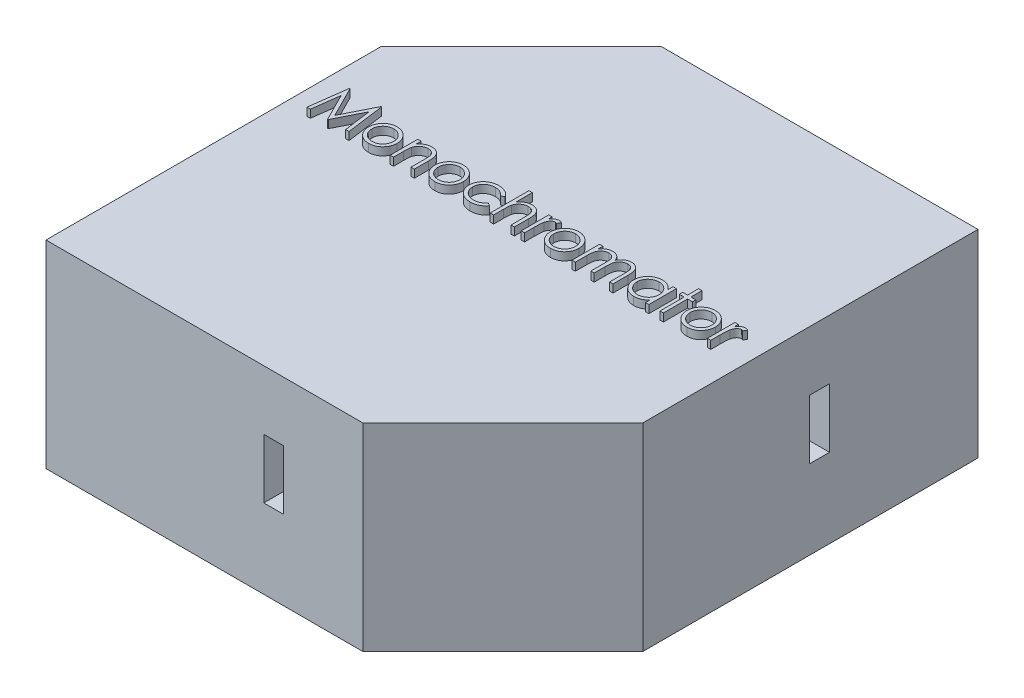
from build123d import *

# Parameters (mm, degrees)
BOSS_EXTRUDE1_DEPTH = 50
SKETCH3_W           = 5
SKETCH3_H           = 15
CUT_EXTRUDE1_DEPTH  = 50
SKETCH4_W           = 5
SKETCH4_H           = 15
CUT_EXTRUDE2_DEPTH  = 50
BOSS_EXTRUDE2_DEPTH = 3
BOSS_EXTRUDE3_DEPTH = 3
BOSS_EXTRUDE4_DEPTH = 2


with BuildPart() as part:
    # Sketch2 → Boss-Extrude1 (new body)
    with BuildSketch(Plane(origin=(0, 0, 0), x_dir=(1, 0, 0), z_dir=(0, 1, 0))):
        Polygon((0, 0), (80, 0), (115.355339059, 35.355339059), (115.355339059, 120), (35.355339059, 120), (0, 84.644660941), align=None)
        Polygon((5, 5), (77.928932188, 5), (110.355339059, 37.426406871), (110.355339059, 115), (37.426406871, 115), (5, 82.573593129), align=None, mode=Mode.SUBTRACT)
    extrude(amount=BOSS_EXTRUDE1_DEPTH)

    # Sketch3 → Cut-Extrude1 (cut)
    with BuildSketch(Plane.XY):
        with Locations((57.5, 27.5)):
            Rectangle(SKETCH3_W, SKETCH3_H)
    extrude(amount=-CUT_EXTRUDE1_DEPTH, mode=Mode.SUBTRACT)

    # Sketch4 → Cut-Extrude2 (cut)
    with BuildSketch(Plane(origin=(115.355339059, 0, 0), x_dir=(0, 0, -1), z_dir=(1, 0, 0))):
        with Locations((80, 27.5)):
            Rectangle(SKETCH4_W, SKETCH4_H)
    extrude(amount=-CUT_EXTRUDE2_DEPTH, mode=Mode.SUBTRACT)

    # Sketch5 → Boss-Extrude2 (add)
    with BuildSketch(Plane.XZ):
        Polygon((0, 0), (0, -84.644660941), (35.355339059, -120), (115.355339059, -120), (115.355339059, -35.355339059), (80, 0), align=None)
    extrude(amount=-BOSS_EXTRUDE2_DEPTH)

    # Sketch6 → Boss-Extrude3 (add)
    with BuildSketch(Plane(origin=(0, 50, 0), x_dir=(1, 0, 0), z_dir=(0, 1, 0))):
        Polygon((35.355339059, 120), (0, 84.644660941), (0, 0), (80, 0), (115.355339059, 35.355339059), (115.355339059, 120), align=None)
    extrude(amount=-BOSS_EXTRUDE3_DEPTH)

    # Sketch7 → Boss-Extrude4 (add)
    # profile 1 of 13: a face of its own
    with BuildSketch(Plane(origin=(0, 50, 0), x_dir=(1, 0, 0), z_dir=(0, 1, 0))):
        Polygon((5.900746453, 60), (7.158153304, 69.525), (7.280268688, 69.525), (11.212765684, 61.709615385), (15.133814361, 69.525), (15.255929746, 69.525), (16.524784914, 60), (15.669977222, 60), (14.754111837, 66.848001803), (11.317708592, 60), (11.123087198, 60), (7.67141953, 66.868990385), (6.761278304, 60), align=None)
    # profile 2 of 13: a face of its own
    with BuildSketch(Plane(origin=(0, 50, 0), x_dir=(1, 0, 0), z_dir=(0, 1, 0))):
        with BuildLine():
            add(Edge.make_bspline(
                [(21.596389482, 67.082692308), (21.726994303, 67.079911304), (21.983078439, 67.074458435), (22.358112757, 67.016179136), (22.716103448, 66.927059523), (23.058421585, 66.8038562), (23.380683075, 66.638714606), (23.687581961, 66.441657893), (23.978276821, 66.208206692), (24.152510922, 66.027617948), (24.24095078, 65.935952524)],
                knots=[0, 0, 0, 0, 1.054011418, 2.066658804, 3.057071809, 4.030435133, 4.997543892, 5.974964718, 6.972108034, 8, 8, 8, 8], degree=3))
            add(Edge.make_bspline(
                [(24.24095078, 65.935952524), (24.317101669, 65.848284463), (24.467929718, 65.674644959), (24.661329996, 65.393097898), (24.827940099, 65.101523767), (24.961461442, 64.796050685), (25.066739971, 64.47934533), (25.141485902, 64.150319142), (25.185945703, 63.809698755), (25.19194092, 63.578366881), (25.194977222, 63.461207933)],
                knots=[0, 0, 0, 0, 1.025258237, 2.030674902, 3.01204498, 3.988269485, 4.97094183, 5.956517959, 6.965070386, 8, 8, 8, 8], degree=3))
            add(Edge.make_bspline(
                [(25.194977222, 63.461207933), (25.192306583, 63.343369919), (25.187029275, 63.110516507), (25.137108433, 62.767563805), (25.05946312, 62.435019323), (24.948342189, 62.114275306), (24.805853335, 61.804351326), (24.631979392, 61.506601053), (24.425500206, 61.220437033), (24.191446472, 60.948289173), (23.93276958, 60.697465403), (23.652146348, 60.478857755), (23.355091442, 60.291564892), (23.037654888, 60.140698647), (22.702735513, 60.021745819), (22.34961092, 59.938197918), (21.978829693, 59.887683621), (21.725662755, 59.881196897), (21.596389482, 59.877884615)],
                knots=[0, 0, 0, 0, 0.998656419, 1.973391657, 2.932242238, 3.890759089, 4.846373663, 5.82037756, 6.809684879, 7.83454468, 8.860553229, 9.859544525, 10.845671541, 11.83227036, 12.833544569, 13.85385346, 14.904124723, 16, 16, 16, 16], degree=3))
            add(Edge.make_bspline(
                [(21.596389482, 59.877884615), (21.466482852, 59.881208014), (21.212054155, 59.887717057), (20.839964162, 59.938001662), (20.486206699, 60.021707315), (20.15084887, 60.141089563), (19.832047536, 60.291569714), (19.533271427, 60.478291526), (19.252420228, 60.697530235), (18.993688613, 60.948271606), (18.759649552, 61.220441559), (18.553166579, 61.506599878), (18.37929362, 61.804351632), (18.236804508, 62.114275225), (18.125683646, 62.435019345), (18.048038315, 62.767563799), (17.998117478, 63.110516509), (17.992840169, 63.343369919), (17.99016953, 63.461207933)],
                knots=[0, 0, 0, 0, 1.099876186, 2.154163076, 3.173186993, 4.173200201, 5.163417411, 6.152872554, 7.150605724, 8.17532212, 9.198891216, 10.186952605, 11.159729845, 12.11414092, 13.071450619, 14.029093627, 15.002601286, 16, 16, 16, 16], degree=3))
            add(Edge.make_bspline(
                [(17.99016953, 63.461207933), (17.993226539, 63.577730104), (17.999278891, 63.808423978), (18.04369399, 64.14840405), (18.118148348, 64.476873373), (18.223553077, 64.792356276), (18.358305132, 65.096490712), (18.522574066, 65.388785288), (18.717947144, 65.669059231), (18.868175312, 65.84247432), (18.944195972, 65.930228365)],
                knots=[0, 0, 0, 0, 1.031353054, 2.041901799, 3.029428768, 4.008703097, 4.981709435, 5.96992636, 6.972712378, 8, 8, 8, 8], degree=3))
            add(Edge.make_bspline(
                [(18.944195972, 65.930228365), (19.032502495, 66.022688736), (19.20617281, 66.204528323), (19.498314705, 66.437298978), (19.804458604, 66.638456293), (20.130281438, 66.800316566), (20.472318359, 66.927784246), (20.832143583, 67.016408969), (21.208450522, 67.074248457), (21.465787776, 67.079849641), (21.596389482, 67.082692308)],
                knots=[0, 0, 0, 0, 1.027980169, 2.021703884, 2.998553061, 3.971491411, 4.943284454, 5.930300938, 6.949603206, 8, 8, 8, 8], degree=3))
        make_face()
        with BuildLine():
            add(Edge.make_bspline(
                [(21.592573376, 66.227884615), (21.500214591, 66.225259548), (21.317881248, 66.220077179), (21.049495092, 66.180660267), (20.791122245, 66.118210274), (20.542272519, 66.029480663), (20.3037851, 65.914911517), (20.075431655, 65.774190908), (19.856540515, 65.609182648), (19.651393614, 65.420144949), (19.463118893, 65.213645685), (19.298532399, 64.993622651), (19.158582645, 64.763644666), (19.041996213, 64.523472577), (18.955163079, 64.270672508), (18.892099354, 64.008107362), (18.852719628, 63.735242193), (18.847585984, 63.54974685), (18.844977222, 63.455483774)],
                knots=[0, 0, 0, 0, 1.021534396, 2.016698045, 2.994645724, 3.958388632, 4.93408049, 5.916473867, 6.921342795, 7.962252576, 8.998418191, 10.008913653, 10.997312074, 11.973003931, 12.956656626, 13.948281152, 14.957379055, 16, 16, 16, 16], degree=3))
            add(Edge.make_bspline(
                [(18.844977222, 63.455483774), (18.849350078, 63.333694329), (18.858029379, 63.091965054), (18.928610272, 62.735971927), (19.046682934, 62.394209887), (19.206124031, 62.068682436), (19.405893812, 61.767495737), (19.641262186, 61.49896834), (19.909703085, 61.267141239), (20.20801656, 61.074788366), (20.530109383, 60.921953602), (20.870985514, 60.813643533), (21.226514831, 60.74323557), (21.469485964, 60.736237486), (21.592573376, 60.732692308)],
                knots=[0, 0, 0, 0, 1.016792936, 2.018143844, 3.017858371, 4.030088057, 5.03801393, 6.028138512, 7.003788237, 7.991172063, 8.984598303, 9.972568034, 10.972917682, 12, 12, 12, 12], degree=3))
            add(Edge.make_bspline(
                [(21.592573376, 60.732692308), (21.715653708, 60.736258142), (21.958610866, 60.743296999), (22.313646197, 60.81328893), (22.653590649, 60.922428178), (22.975348925, 61.074616478), (23.27352661, 61.267871693), (23.543898148, 61.497659262), (23.777256868, 61.768206957), (23.976829036, 62.069081375), (24.138881243, 62.393705219), (24.256401242, 62.736035004), (24.327151815, 63.09194899), (24.335808213, 63.333688947), (24.34016953, 63.455483774)],
                knots=[0, 0, 0, 0, 1.02726834, 2.027799167, 3.010890988, 4.004497153, 4.992059811, 5.971914811, 6.958719428, 7.966827853, 8.981595046, 9.981490638, 10.983022906, 12, 12, 12, 12], degree=3))
            add(Edge.make_bspline(
                [(24.34016953, 63.455483774), (24.337561666, 63.549747413), (24.332429789, 63.735243864), (24.293037208, 64.00810097), (24.23002106, 64.270695958), (24.143012588, 64.523386053), (24.026932736, 64.764266511), (23.884284177, 64.992947411), (23.720369744, 65.214407869), (23.529823151, 65.41947742), (23.324890387, 65.609256341), (23.105910533, 65.774254893), (22.877895698, 65.914293064), (22.640101127, 66.030460619), (22.391219496, 66.117403023), (22.133208666, 66.181020856), (21.865967619, 66.219910606), (21.684287651, 66.225209612), (21.592573376, 66.227884615)],
                knots=[0, 0, 0, 0, 1.042956736, 2.052379634, 3.044323526, 4.02829302, 5.004299113, 5.996692471, 7.007513377, 8.048758398, 9.090003419, 10.095195979, 11.07790575, 12.047570684, 13.018257071, 13.989683339, 14.985167495, 16, 16, 16, 16], degree=3))
        make_face(mode=Mode.SUBTRACT)
    # profile 3 of 13: a face of its own
    with BuildSketch(Plane(origin=(0, 50, 0), x_dir=(1, 0, 0), z_dir=(0, 1, 0))):
        with BuildLine():
            Line((26.904592607, 66.960576923), (27.759400299, 66.960576923))
            Line((27.759400299, 66.960576923), (27.759400299, 65.705078125))
            add(Edge.make_bspline(
                [(27.759400299, 65.705078125), (27.850670577, 65.818950106), (28.027783737, 66.039922659), (28.322743958, 66.33035508), (28.634467001, 66.569691728), (28.961043882, 66.760474196), (29.302917931, 66.904292514), (29.658005223, 67.00815837), (30.028431673, 67.070437796), (30.280339176, 67.078575494), (30.407777703, 67.082692308)],
                knots=[0, 0, 0, 0, 1.12780773, 2.188550248, 3.19190651, 4.159438251, 5.104880172, 6.052711206, 7.014878035, 8, 8, 8, 8], degree=3))
            add(Edge.make_bspline(
                [(30.407777703, 67.082692308), (30.536584643, 67.077942883), (30.788690894, 67.068647113), (31.155751904, 66.995123118), (31.498579497, 66.869542102), (31.815951288, 66.697514968), (32.10204749, 66.483593065), (32.353302979, 66.234370673), (32.561120102, 65.947706047), (32.700450069, 65.681759457), (32.79223201, 65.445842096), (32.8500143, 65.243784869), (32.899084328, 65.018673329), (32.941625013, 64.771187733), (32.970409868, 64.499594087), (32.993112818, 64.205005725), (33.009383408, 63.88751807), (33.01002895, 63.667935176), (33.010361837, 63.554702524)],
                knots=[0, 0, 0, 0, 1.235846778, 2.418850247, 3.575807741, 4.728682307, 5.871620074, 6.994088408, 8.11269785, 9.256955736, 9.865816715, 10.540099792, 11.271859618, 12.076849838, 12.949306005, 13.892391288, 14.913166135, 16, 16, 16, 16], degree=3))
            Line((33.010361837, 63.554702524), (33.010361837, 60))
            Line((33.010361837, 60), (32.155554145, 60))
            Line((32.155554145, 60), (32.155554145, 63.27421875))
            add(Edge.make_bspline(
                [(32.155554145, 63.27421875), (32.155028343, 63.368985547), (32.154022574, 63.5502583), (32.15085035, 63.809798285), (32.143203662, 64.04516533), (32.13245861, 64.255796737), (32.116731391, 64.44149025), (32.10034123, 64.602624067), (32.080297972, 64.738993607), (32.062437473, 64.821085725), (32.054427342, 64.857902644)],
                knots=[0, 0, 0, 0, 1.430800155, 2.736877192, 3.918605307, 4.986035426, 5.920637409, 6.731861385, 7.431261377, 8, 8, 8, 8], degree=3))
            add(Edge.make_bspline(
                [(32.054427342, 64.857902644), (32.025510717, 64.965973798), (31.969855161, 65.173977331), (31.832330535, 65.456119676), (31.6586648, 65.696144745), (31.446671367, 65.892568537), (31.198397954, 66.045433457), (30.914533516, 66.151498291), (30.597817358, 66.217836567), (30.375056502, 66.224441833), (30.258949578, 66.227884615)],
                knots=[0, 0, 0, 0, 1.084156227, 2.086665306, 3.027808233, 3.945421172, 4.874247719, 5.839848303, 6.874090471, 8, 8, 8, 8], degree=3))
            add(Edge.make_bspline(
                [(30.258949578, 66.227884615), (30.190185382, 66.226589203), (30.054102814, 66.224025614), (29.852308962, 66.198304582), (29.656572462, 66.156235499), (29.464928894, 66.099442993), (29.281211255, 66.021440675), (29.099517005, 65.932914317), (28.926687883, 65.822565254), (28.759038638, 65.699582206), (28.603065926, 65.563295221), (28.457936662, 65.419482661), (28.328565335, 65.266332625), (28.211357012, 65.106312768), (28.110179024, 64.937225409), (28.021860263, 64.760701832), (27.946923836, 64.576509698), (27.909687366, 64.448670424), (27.891055948, 64.384705529)],
                knots=[0, 0, 0, 0, 1.023777757, 2.026029729, 3.023749952, 4.003683103, 4.997618607, 5.993177895, 7.010360494, 8.046726602, 9.087585522, 10.09234134, 11.086953743, 12.070360549, 13.043493632, 14.017870808, 15.008233677, 16, 16, 16, 16], degree=3))
            add(Edge.make_bspline(
                [(27.891055948, 64.384705529), (27.880334476, 64.337746726), (27.856994392, 64.235519869), (27.831785309, 64.067758985), (27.808904693, 63.873693982), (27.789754113, 63.653551319), (27.77803723, 63.406560245), (27.765261764, 63.133775572), (27.760610677, 62.834109578), (27.759815056, 62.625480258), (27.759400299, 62.516721755)],
                knots=[0, 0, 0, 0, 0.615963638, 1.340920617, 2.168419149, 3.115676021, 4.16674242, 5.331190069, 6.6087489, 8, 8, 8, 8], degree=3))
            Line((27.759400299, 62.516721755), (27.759400299, 60))
            Line((27.759400299, 60), (26.904592607, 60))
            Line((26.904592607, 60), (26.904592607, 66.960576923))
        make_face()
    # profile 4 of 13: a face of its own
    with BuildSketch(Plane(origin=(0, 50, 0), x_dir=(1, 0, 0), z_dir=(0, 1, 0))):
        with BuildLine():
            add(Edge.make_bspline(
                [(38.326197174, 67.082692308), (38.456801995, 67.079911304), (38.712886131, 67.074458435), (39.087920449, 67.016179136), (39.44591114, 66.927059523), (39.788229278, 66.8038562), (40.110490767, 66.638714606), (40.417389653, 66.441657893), (40.708084513, 66.208206692), (40.882318614, 66.027617948), (40.970758472, 65.935952524)],
                knots=[0, 0, 0, 0, 1.054011418, 2.066658804, 3.057071809, 4.030435133, 4.997543892, 5.974964718, 6.972108034, 8, 8, 8, 8], degree=3))
            add(Edge.make_bspline(
                [(40.970758472, 65.935952524), (41.046909361, 65.848284463), (41.19773741, 65.674644959), (41.391137688, 65.393097898), (41.557747791, 65.101523767), (41.691269135, 64.796050685), (41.796547663, 64.47934533), (41.871293594, 64.150319142), (41.915753395, 63.809698755), (41.921748613, 63.578366881), (41.924784914, 63.461207933)],
                knots=[0, 0, 0, 0, 1.025258237, 2.030674902, 3.01204498, 3.988269485, 4.97094183, 5.956517959, 6.965070386, 8, 8, 8, 8], degree=3))
            add(Edge.make_bspline(
                [(41.924784914, 63.461207933), (41.922114275, 63.343369919), (41.916836967, 63.110516507), (41.866916125, 62.767563805), (41.789270813, 62.435019323), (41.678149882, 62.114275306), (41.535661027, 61.804351326), (41.361787085, 61.506601053), (41.155307898, 61.220437033), (40.921254164, 60.948289173), (40.662577273, 60.697465403), (40.38195404, 60.478857755), (40.084899134, 60.291564892), (39.76746258, 60.140698647), (39.432543205, 60.021745819), (39.079418613, 59.938197918), (38.708637385, 59.887683621), (38.455470447, 59.881196897), (38.326197174, 59.877884615)],
                knots=[0, 0, 0, 0, 0.998656419, 1.973391657, 2.932242238, 3.890759089, 4.846373663, 5.82037756, 6.809684879, 7.83454468, 8.860553229, 9.859544525, 10.845671541, 11.83227036, 12.833544569, 13.85385346, 14.904124723, 16, 16, 16, 16], degree=3))
            add(Edge.make_bspline(
                [(38.326197174, 59.877884615), (38.196290544, 59.881208014), (37.941861848, 59.887717057), (37.569771854, 59.938001662), (37.216014391, 60.021707315), (36.880656562, 60.141089563), (36.561855229, 60.291569714), (36.263079119, 60.478291526), (35.98222792, 60.697530235), (35.723496306, 60.948271606), (35.489457244, 61.220441559), (35.282974271, 61.506599878), (35.109101312, 61.804351632), (34.9666122, 62.114275225), (34.855491338, 62.435019345), (34.777846007, 62.767563799), (34.72792517, 63.110516509), (34.722647862, 63.343369919), (34.719977222, 63.461207933)],
                knots=[0, 0, 0, 0, 1.099876186, 2.154163076, 3.173186993, 4.173200201, 5.163417411, 6.152872554, 7.150605724, 8.17532212, 9.198891216, 10.186952605, 11.159729845, 12.11414092, 13.071450619, 14.029093627, 15.002601286, 16, 16, 16, 16], degree=3))
            add(Edge.make_bspline(
                [(34.719977222, 63.461207933), (34.723034231, 63.577730104), (34.729086583, 63.808423978), (34.773501683, 64.14840405), (34.84795604, 64.476873373), (34.953360769, 64.792356276), (35.088112824, 65.096490712), (35.252381758, 65.388785288), (35.447754836, 65.669059231), (35.597983004, 65.84247432), (35.674003664, 65.930228365)],
                knots=[0, 0, 0, 0, 1.031353054, 2.041901799, 3.029428768, 4.008703097, 4.981709435, 5.96992636, 6.972712378, 8, 8, 8, 8], degree=3))
            add(Edge.make_bspline(
                [(35.674003664, 65.930228365), (35.762310187, 66.022688736), (35.935980502, 66.204528323), (36.228122397, 66.437298978), (36.534266296, 66.638456293), (36.860089131, 66.800316566), (37.202126051, 66.927784246), (37.561951275, 67.016408969), (37.938258214, 67.074248457), (38.195595468, 67.079849641), (38.326197174, 67.082692308)],
                knots=[0, 0, 0, 0, 1.027980169, 2.021703884, 2.998553061, 3.971491411, 4.943284454, 5.930300938, 6.949603206, 8, 8, 8, 8], degree=3))
        make_face()
        with BuildLine():
            add(Edge.make_bspline(
                [(38.322381068, 66.227884615), (38.230022283, 66.225259548), (38.04768894, 66.220077179), (37.779302784, 66.180660267), (37.520929937, 66.118210274), (37.272080211, 66.029480663), (37.033592792, 65.914911517), (36.805239347, 65.774190908), (36.586348207, 65.609182648), (36.381201306, 65.420144949), (36.192926585, 65.213645685), (36.028340091, 64.993622651), (35.888390338, 64.763644666), (35.771803905, 64.523472577), (35.684970772, 64.270672508), (35.621907046, 64.008107362), (35.58252732, 63.735242193), (35.577393676, 63.54974685), (35.574784914, 63.455483774)],
                knots=[0, 0, 0, 0, 1.021534396, 2.016698045, 2.994645724, 3.958388632, 4.93408049, 5.916473867, 6.921342795, 7.962252576, 8.998418191, 10.008913653, 10.997312074, 11.973003931, 12.956656626, 13.948281152, 14.957379055, 16, 16, 16, 16], degree=3))
            add(Edge.make_bspline(
                [(35.574784914, 63.455483774), (35.57915777, 63.333694329), (35.587837071, 63.091965054), (35.658417964, 62.735971927), (35.776490626, 62.394209887), (35.935931723, 62.068682436), (36.135701504, 61.767495737), (36.371069878, 61.49896834), (36.639510777, 61.267141239), (36.937824253, 61.074788366), (37.259917075, 60.921953602), (37.600793206, 60.813643533), (37.956322523, 60.74323557), (38.199293656, 60.736237486), (38.322381068, 60.732692308)],
                knots=[0, 0, 0, 0, 1.016792936, 2.018143844, 3.017858371, 4.030088057, 5.03801393, 6.028138512, 7.003788237, 7.991172063, 8.984598303, 9.972568034, 10.972917682, 12, 12, 12, 12], degree=3))
            add(Edge.make_bspline(
                [(38.322381068, 60.732692308), (38.445461401, 60.736258142), (38.688418558, 60.743296999), (39.04345389, 60.81328893), (39.383398342, 60.922428178), (39.705156618, 61.074616478), (40.003334303, 61.267871693), (40.27370584, 61.497659262), (40.50706456, 61.768206957), (40.706636728, 62.069081375), (40.868688935, 62.393705219), (40.986208934, 62.736035004), (41.056959507, 63.09194899), (41.065615905, 63.333688947), (41.069977222, 63.455483774)],
                knots=[0, 0, 0, 0, 1.02726834, 2.027799167, 3.010890988, 4.004497153, 4.992059811, 5.971914811, 6.958719428, 7.966827853, 8.981595046, 9.981490638, 10.983022906, 12, 12, 12, 12], degree=3))
            add(Edge.make_bspline(
                [(41.069977222, 63.455483774), (41.067369359, 63.549747413), (41.062237481, 63.735243864), (41.0228449, 64.00810097), (40.959828753, 64.270695958), (40.87282028, 64.523386053), (40.756740428, 64.764266511), (40.61409187, 64.992947411), (40.450177436, 65.214407869), (40.259630843, 65.41947742), (40.054698079, 65.609256341), (39.835718225, 65.774254893), (39.60770339, 65.914293064), (39.369908819, 66.030460619), (39.121027188, 66.117403023), (38.863016358, 66.181020856), (38.595775311, 66.219910606), (38.414095344, 66.225209612), (38.322381068, 66.227884615)],
                knots=[0, 0, 0, 0, 1.042956736, 2.052379634, 3.044323526, 4.02829302, 5.004299113, 5.996692471, 7.007513377, 8.048758398, 9.090003419, 10.095195979, 11.07790575, 12.047570684, 13.018257071, 13.989683339, 14.985167495, 16, 16, 16, 16], degree=3))
        make_face(mode=Mode.SUBTRACT)
    # profile 5 of 13: a face of its own
    with BuildSketch(Plane(origin=(0, 50, 0), x_dir=(1, 0, 0), z_dir=(0, 1, 0))):
        with BuildLine():
            Line((50.472861837, 65.451307091), (49.757342006, 65.006730769))
            add(Edge.make_bspline(
                [(49.757342006, 65.006730769), (49.678883586, 65.104235184), (49.524451509, 65.29615607), (49.256284015, 65.543833102), (48.970502952, 65.756559123), (48.662224837, 65.929924331), (48.331882052, 66.063876993), (47.98077735, 66.158664909), (47.608960797, 66.217731456), (47.354057649, 66.224444776), (47.223447775, 66.227884615)],
                knots=[0, 0, 0, 0, 1.026593902, 2.0206758, 2.988051866, 3.946915611, 4.916868779, 5.907761954, 6.927957743, 8, 8, 8, 8], degree=3))
            add(Edge.make_bspline(
                [(47.223447775, 66.227884615), (47.119056614, 66.225008495), (46.91346106, 66.219344054), (46.611637885, 66.183936925), (46.324139767, 66.119596888), (46.049164695, 66.034821785), (45.788668413, 65.921201353), (45.541968413, 65.782926231), (45.306876473, 65.622225764), (45.090205198, 65.436051351), (44.892006257, 65.233580691), (44.72028707, 65.016536706), (44.57078013, 64.791420431), (44.453470349, 64.552610332), (44.357471492, 64.305569787), (44.294316061, 64.045635651), (44.252229997, 63.776138002), (44.247414896, 63.592391663), (44.244977222, 63.49936899)],
                knots=[0, 0, 0, 0, 1.112346261, 2.190735716, 3.231507886, 4.247384806, 5.251966152, 6.253067467, 7.256802811, 8.280671706, 9.291813951, 10.270744147, 11.225547591, 12.165006084, 13.100104208, 14.043489273, 15.009504848, 16, 16, 16, 16], degree=3))
            add(Edge.make_bspline(
                [(44.244977222, 63.49936899), (44.24981933, 63.37753278), (44.259438302, 63.135501998), (44.334825846, 62.778238021), (44.458227412, 62.432824263), (44.62711342, 62.101713119), (44.840683335, 61.795296168), (45.091524383, 61.520476909), (45.379775602, 61.282580433), (45.702897159, 61.085351632), (46.053302161, 60.926797482), (46.427199518, 60.81383824), (46.82153392, 60.745659998), (47.091517996, 60.737071324), (47.229171934, 60.732692308)],
                knots=[0, 0, 0, 0, 0.966302908, 1.919585723, 2.883856336, 3.870342332, 4.860282998, 5.839159637, 6.814385684, 7.815993281, 8.834850808, 9.858348828, 10.908058873, 12, 12, 12, 12], degree=3))
            add(Edge.make_bspline(
                [(47.229171934, 60.732692308), (47.355324257, 60.736228796), (47.603247048, 60.743178935), (47.965652303, 60.801768471), (48.310674774, 60.897681503), (48.638302201, 61.031433322), (48.94793591, 61.204318919), (49.237575307, 61.417567805), (49.51298371, 61.665045267), (49.674900482, 61.856410603), (49.757342006, 61.953846154)],
                knots=[0, 0, 0, 0, 1.039848629, 2.043578496, 3.018386758, 3.987534228, 4.954977003, 5.934852016, 6.948509513, 8, 8, 8, 8], degree=3))
            Line((49.757342006, 61.953846154), (50.472861837, 61.484465144))
            add(Edge.make_bspline(
                [(50.472861837, 61.484465144), (50.430441019, 61.422169666), (50.345740183, 61.297785476), (50.204150716, 61.122405416), (50.051424603, 60.958244266), (49.888157675, 60.805522076), (49.71648177, 60.660584181), (49.530532244, 60.530359538), (49.336304945, 60.407528342), (49.131519737, 60.297003312), (48.918293909, 60.197653965), (48.696927494, 60.112225136), (48.468382432, 60.038827919), (48.232390009, 59.980487711), (47.988484971, 59.933921787), (47.737298109, 59.903023499), (47.478915933, 59.879958627), (47.304276007, 59.878581946), (47.215815563, 59.877884615)],
                knots=[0, 0, 0, 0, 0.954134338, 1.905101784, 2.851144739, 3.791306361, 4.734911809, 5.6936923, 6.663572882, 7.643865596, 8.638447847, 9.640600242, 10.646758161, 11.676244097, 12.717260333, 13.78922464, 14.880174919, 16, 16, 16, 16], degree=3))
            add(Edge.make_bspline(
                [(47.215815563, 59.877884615), (47.080803087, 59.88031017), (46.816177654, 59.885064274), (46.428857115, 59.937338768), (46.058705635, 60.016144852), (45.705849675, 60.129257585), (45.370234302, 60.274867009), (45.052172459, 60.452731184), (44.752717295, 60.664327126), (44.474830093, 60.905888663), (44.219610586, 61.167800693), (44.000464311, 61.450420827), (43.810385396, 61.74335825), (43.657747154, 62.053082746), (43.536243732, 62.375477795), (43.453227009, 62.713126091), (43.399533938, 63.063244011), (43.393319883, 63.302002783), (43.39016953, 63.423046875)],
                knots=[0, 0, 0, 0, 1.1129367, 2.181364009, 3.217532258, 4.231199276, 5.232079859, 6.230262199, 7.231623845, 8.250719726, 9.263571943, 10.242672461, 11.195837495, 12.138959767, 13.085126421, 14.0317438, 15.002148558, 16, 16, 16, 16], degree=3))
            add(Edge.make_bspline(
                [(43.39016953, 63.423046875), (43.391369724, 63.505175329), (43.393757107, 63.66854238), (43.421139925, 63.91100824), (43.456514341, 64.150245067), (43.516455811, 64.38322036), (43.585690673, 64.613467614), (43.674070513, 64.838211625), (43.777744409, 65.05849677), (43.895451494, 65.273755592), (44.027954436, 65.480446838), (44.174588364, 65.675719311), (44.32983045, 65.861918816), (44.500943298, 66.032617051), (44.680665499, 66.194640543), (44.874081715, 66.343660867), (45.080082569, 66.480115992), (45.295574325, 66.606529113), (45.520431576, 66.719085861), (45.753295157, 66.816059173), (45.992761901, 66.898933683), (46.239214865, 66.964544384), (46.491018236, 67.019564658), (46.750156306, 67.054175368), (47.01563771, 67.078630868), (47.195404458, 67.081327238), (47.28641352, 67.082692308)],
                knots=[0, 0, 0, 0, 0.990994727, 1.971252077, 2.943264845, 3.907940874, 4.872158414, 5.844625996, 6.82015047, 7.809835459, 8.804511986, 9.781214284, 10.756496977, 11.728388426, 12.696359165, 13.676225489, 14.672885716, 15.677705647, 16.690706858, 17.706033469, 18.721040654, 19.747369689, 20.783475414, 21.830280724, 22.901553713, 24, 24, 24, 24], degree=3))
            add(Edge.make_bspline(
                [(47.28641352, 67.082692308), (47.400387243, 67.080183447), (47.627764994, 67.075178266), (47.965060774, 67.03305422), (48.297388552, 66.969545829), (48.618917455, 66.875458343), (48.92574904, 66.761529394), (49.21295623, 66.63358765), (49.473778227, 66.485012336), (49.71306688, 66.32248831), (49.931269709, 66.139170417), (50.130626579, 65.932867197), (50.315225567, 65.704652336), (50.41988276, 65.536452453), (50.472861837, 65.451307091)],
                knots=[0, 0, 0, 0, 1.095225653, 2.184976855, 3.262915854, 4.344593502, 5.400796181, 6.407717688, 7.363229445, 8.282371371, 9.184954523, 10.097238608, 11.036792983, 12, 12, 12, 12], degree=3))
        make_face()
    # profile 6 of 13: a face of its own
    with BuildSketch(Plane(origin=(0, 50, 0), x_dir=(1, 0, 0), z_dir=(0, 1, 0))):
        with BuildLine():
            Line((52.182477222, 69.769230769), (53.037284914, 69.769230769))
            Line((53.037284914, 69.769230769), (53.037284914, 65.645928486))
            add(Edge.make_bspline(
                [(53.037284914, 65.645928486), (53.129044142, 65.760620323), (53.307704061, 65.983931206), (53.60841135, 66.27529059), (53.917214223, 66.527835409), (54.244778456, 66.728868582), (54.585094515, 66.887681746), (54.939597719, 67.00031527), (55.308353933, 67.069578611), (55.558793806, 67.078282877), (55.685662318, 67.082692308)],
                knots=[0, 0, 0, 0, 1.125788106, 2.19196713, 3.20547328, 4.180437432, 5.132270164, 6.079753143, 7.027236121, 8, 8, 8, 8], degree=3))
            add(Edge.make_bspline(
                [(55.685662318, 67.082692308), (55.814468601, 67.077942244), (56.066573568, 67.068645223), (56.433643834, 66.995130236), (56.776437358, 66.869516066), (57.093935116, 66.697611519), (57.379208042, 66.483509039), (57.631892043, 66.236317538), (57.838287359, 65.949822089), (57.978710671, 65.685146141), (58.070078302, 65.449637104), (58.127913629, 65.247607738), (58.176951591, 65.02248596), (58.2196773, 64.774387653), (58.24815319, 64.502121865), (58.271025758, 64.20691693), (58.287290251, 63.888789772), (58.287920546, 63.668571094), (58.288246453, 63.554702524)],
                knots=[0, 0, 0, 0, 1.235656852, 2.418478516, 3.575258207, 4.727955599, 5.870717718, 6.98870536, 8.107142894, 9.245821548, 9.854588956, 10.528768408, 11.260415777, 12.065282286, 12.943670737, 13.886611085, 14.907229059, 16, 16, 16, 16], degree=3))
            Line((58.288246453, 63.554702524), (58.288246453, 60))
            Line((58.288246453, 60), (57.43343876, 60))
            Line((57.43343876, 60), (57.43343876, 63.27421875))
            add(Edge.make_bspline(
                [(57.43343876, 63.27421875), (57.432920864, 63.368986158), (57.431930216, 63.550260081), (57.4286554, 63.809792133), (57.421345057, 64.045185185), (57.409531809, 64.255684832), (57.397107651, 64.441584538), (57.380008052, 64.602614336), (57.360113773, 64.738995396), (57.342237303, 64.821086278), (57.33422001, 64.857902644)],
                knots=[0, 0, 0, 0, 1.430932559, 2.737130458, 3.918967929, 4.986496826, 5.920444988, 6.731744033, 7.431208747, 8, 8, 8, 8], degree=3))
            add(Edge.make_bspline(
                [(57.33422001, 64.857902644), (57.303129743, 64.965927747), (57.243358886, 65.173605379), (57.104435463, 65.455715224), (56.930919868, 65.696247983), (56.719064106, 65.891957581), (56.472615987, 66.045477556), (56.189968513, 66.151797735), (55.87378187, 66.217786178), (55.651028936, 66.224424568), (55.53492614, 66.227884615)],
                knots=[0, 0, 0, 0, 1.090059168, 2.095632401, 3.037101401, 3.955032261, 4.878929692, 5.839099886, 6.873700383, 8, 8, 8, 8], degree=3))
            add(Edge.make_bspline(
                [(55.53492614, 66.227884615), (55.4661617, 66.226589688), (55.330078651, 66.22402706), (55.128288353, 66.198298951), (54.932538544, 66.156256367), (54.740944046, 66.099366158), (54.557565487, 66.021953662), (54.377057688, 65.932336504), (54.204534876, 65.822640467), (54.036933475, 65.699561771), (53.880947902, 65.563300497), (53.735821966, 65.419481283), (53.606449769, 65.266332988), (53.489241675, 65.106312672), (53.388063626, 64.937225434), (53.299744881, 64.760701825), (53.22480845, 64.5765097), (53.187571981, 64.448670425), (53.168940563, 64.384705529)],
                knots=[0, 0, 0, 0, 1.024319606, 2.027102035, 3.025350316, 4.005802111, 5.00026367, 5.987881639, 7.005602596, 8.042517216, 9.083927026, 10.089214625, 11.084353441, 12.06828073, 13.041928858, 14.016821737, 15.00770877, 16, 16, 16, 16], degree=3))
            add(Edge.make_bspline(
                [(53.168940563, 64.384705529), (53.158219693, 64.338384227), (53.134857599, 64.237444408), (53.109507945, 64.070962855), (53.086817227, 63.877506371), (53.067635102, 63.65736838), (53.055870132, 63.409742214), (53.043193062, 63.136317675), (53.038474067, 62.835382047), (53.037693145, 62.626116416), (53.037284914, 62.516721755)],
                knots=[0, 0, 0, 0, 0.607992626, 1.324890765, 2.152360218, 3.099583803, 4.150613268, 5.323148443, 6.60066238, 8, 8, 8, 8], degree=3))
            Line((53.037284914, 62.516721755), (53.037284914, 60))
            Line((53.037284914, 60), (52.182477222, 60))
            Line((52.182477222, 60), (52.182477222, 69.769230769))
        make_face()
    # profile 7 of 13: a face of its own
    with BuildSketch(Plane(origin=(0, 50, 0), x_dir=(1, 0, 0), z_dir=(0, 1, 0))):
        with BuildLine():
            Line((59.997861837, 66.960576923), (60.85266953, 66.960576923))
            Line((60.85266953, 66.960576923), (60.85266953, 65.935952524))
            add(Edge.make_bspline(
                [(60.85266953, 65.935952524), (60.91577608, 66.031354457), (61.036466868, 66.213809912), (61.23707134, 66.455117081), (61.442548263, 66.654910887), (61.653881308, 66.814124034), (61.872624566, 66.933358307), (62.09397727, 67.02069721), (62.321421942, 67.072342618), (62.474262607, 67.07923779), (62.550836597, 67.082692308)],
                knots=[0, 0, 0, 0, 1.2804753, 2.448899062, 3.506932113, 4.484331642, 5.4025378, 6.288909075, 7.142734305, 8, 8, 8, 8], degree=3))
            add(Edge.make_bspline(
                [(62.550836597, 67.082692308), (62.610235385, 67.079452375), (62.732452253, 67.072786002), (62.917462015, 67.025947972), (63.108080267, 66.951168496), (63.230932049, 66.880846176), (63.294977222, 66.844185697)],
                knots=[0, 0, 0, 0, 0.901110191, 1.854092781, 2.881294221, 4, 4, 4, 4], degree=3))
            Line((63.294977222, 66.844185697), (62.825596212, 66.103861178))
            add(Edge.make_bspline(
                [(62.825596212, 66.103861178), (62.784478091, 66.122204331), (62.706428024, 66.157023146), (62.592251669, 66.198231045), (62.486983174, 66.222495073), (62.41991749, 66.226170954), (62.388652102, 66.227884615)],
                knots=[0, 0, 0, 0, 1.180555205, 2.24091978, 3.179933427, 4, 4, 4, 4], degree=3))
            add(Edge.make_bspline(
                [(62.388652102, 66.227884615), (62.320056498, 66.223312514), (62.180141351, 66.213986752), (61.974715678, 66.14067471), (61.77537864, 66.022223878), (61.617068616, 65.890857495), (61.494489342, 65.764180989), (61.407022014, 65.653559265), (61.326786824, 65.529520275), (61.250123582, 65.394184493), (61.180274595, 65.245241126), (61.115083674, 65.084178238), (61.056140626, 64.910809281), (61.022530318, 64.790025422), (61.00531376, 64.728155048)],
                knots=[0, 0, 0, 0, 1.125678352, 2.296057538, 3.5422874, 4.923748041, 5.663163013, 6.437101912, 7.23742474, 8.08941207, 8.991984279, 9.93940061, 10.944477711, 12, 12, 12, 12], degree=3))
            add(Edge.make_bspline(
                [(61.00531376, 64.728155048), (60.99243489, 64.672972169), (60.96390917, 64.550746284), (60.936173628, 64.345690656), (60.908770154, 64.103419127), (60.889457214, 63.823257328), (60.871555542, 63.505904891), (60.861458819, 63.150878354), (60.853013843, 62.757813305), (60.852787783, 62.483018815), (60.85266953, 62.339272837)],
                knots=[0, 0, 0, 0, 0.566838948, 1.255505196, 2.06880316, 3.007127437, 4.065329342, 5.249902469, 6.561414163, 8, 8, 8, 8], degree=3))
            Line((60.85266953, 62.339272837), (60.85266953, 60))
            Line((60.85266953, 60), (59.997861837, 60))
            Line((59.997861837, 60), (59.997861837, 66.960576923))
        make_face()
    # profile 8 of 13: a face of its own
    with BuildSketch(Plane(origin=(0, 50, 0), x_dir=(1, 0, 0), z_dir=(0, 1, 0))):
        with BuildLine():
            add(Edge.make_bspline(
                [(67.511774097, 67.082692308), (67.642378918, 67.079911304), (67.898463054, 67.074458435), (68.273497372, 67.016179136), (68.631488063, 66.927059523), (68.973806201, 66.8038562), (69.29606769, 66.638714606), (69.602966576, 66.441657893), (69.893661436, 66.208206692), (70.067895537, 66.027617948), (70.156335395, 65.935952524)],
                knots=[0, 0, 0, 0, 1.054011418, 2.066658804, 3.057071809, 4.030435133, 4.997543892, 5.974964718, 6.972108034, 8, 8, 8, 8], degree=3))
            add(Edge.make_bspline(
                [(70.156335395, 65.935952524), (70.232486284, 65.848284463), (70.383314333, 65.674644959), (70.576714611, 65.393097898), (70.743324714, 65.101523767), (70.876846058, 64.796050685), (70.982124587, 64.47934533), (71.056870517, 64.150319142), (71.101330319, 63.809698755), (71.107325536, 63.578366881), (71.110361837, 63.461207933)],
                knots=[0, 0, 0, 0, 1.025258237, 2.030674902, 3.01204498, 3.988269485, 4.97094183, 5.956517959, 6.965070386, 8, 8, 8, 8], degree=3))
            add(Edge.make_bspline(
                [(71.110361837, 63.461207933), (71.107691198, 63.343369919), (71.10241389, 63.110516507), (71.052493048, 62.767563805), (70.974847736, 62.435019323), (70.863726805, 62.114275306), (70.72123795, 61.804351326), (70.547364008, 61.506601053), (70.340884821, 61.220437033), (70.106831087, 60.948289173), (69.848154196, 60.697465403), (69.567530963, 60.478857755), (69.270476057, 60.291564892), (68.953039503, 60.140698647), (68.618120128, 60.021745819), (68.264995536, 59.938197918), (67.894214309, 59.887683621), (67.64104737, 59.881196897), (67.511774097, 59.877884615)],
                knots=[0, 0, 0, 0, 0.998656419, 1.973391657, 2.932242238, 3.890759089, 4.846373663, 5.82037756, 6.809684879, 7.83454468, 8.860553229, 9.859544525, 10.845671541, 11.83227036, 12.833544569, 13.85385346, 14.904124723, 16, 16, 16, 16], degree=3))
            add(Edge.make_bspline(
                [(67.511774097, 59.877884615), (67.381867467, 59.881208014), (67.127438771, 59.887717057), (66.755348777, 59.938001662), (66.401591314, 60.021707315), (66.066233485, 60.141089563), (65.747432152, 60.291569714), (65.448656042, 60.478291526), (65.167804843, 60.697530235), (64.909073229, 60.948271606), (64.675034167, 61.220441559), (64.468551194, 61.506599878), (64.294678235, 61.804351632), (64.152189123, 62.114275225), (64.041068261, 62.435019345), (63.96342293, 62.767563799), (63.913502094, 63.110516509), (63.908224785, 63.343369919), (63.905554145, 63.461207933)],
                knots=[0, 0, 0, 0, 1.099876186, 2.154163076, 3.173186993, 4.173200201, 5.163417411, 6.152872554, 7.150605724, 8.17532212, 9.198891216, 10.186952605, 11.159729845, 12.11414092, 13.071450619, 14.029093627, 15.002601286, 16, 16, 16, 16], degree=3))
            add(Edge.make_bspline(
                [(63.905554145, 63.461207933), (63.908611154, 63.577730104), (63.914663506, 63.808423978), (63.959078606, 64.14840405), (64.033532963, 64.476873373), (64.138937692, 64.792356276), (64.273689747, 65.096490712), (64.437958681, 65.388785288), (64.633331759, 65.669059231), (64.783559928, 65.84247432), (64.859580587, 65.930228365)],
                knots=[0, 0, 0, 0, 1.031353054, 2.041901799, 3.029428768, 4.008703097, 4.981709435, 5.96992636, 6.972712378, 8, 8, 8, 8], degree=3))
            add(Edge.make_bspline(
                [(64.859580587, 65.930228365), (64.94788711, 66.022688736), (65.121557425, 66.204528323), (65.41369932, 66.437298978), (65.719843219, 66.638456293), (66.045666054, 66.800316566), (66.387702974, 66.927784246), (66.747528198, 67.016408969), (67.123835137, 67.074248457), (67.381172392, 67.079849641), (67.511774097, 67.082692308)],
                knots=[0, 0, 0, 0, 1.027980169, 2.021703884, 2.998553061, 3.971491411, 4.943284454, 5.930300938, 6.949603206, 8, 8, 8, 8], degree=3))
        make_face()
        with BuildLine():
            add(Edge.make_bspline(
                [(67.507957991, 66.227884615), (67.415599206, 66.225259548), (67.233265863, 66.220077179), (66.964879708, 66.180660267), (66.70650686, 66.118210274), (66.457657134, 66.029480663), (66.219169715, 65.914911517), (65.99081627, 65.774190908), (65.77192513, 65.609182648), (65.566778229, 65.420144949), (65.378503508, 65.213645685), (65.213917014, 64.993622651), (65.073967261, 64.763644666), (64.957380828, 64.523472577), (64.870547695, 64.270672508), (64.807483969, 64.008107362), (64.768104244, 63.735242193), (64.762970599, 63.54974685), (64.760361837, 63.455483774)],
                knots=[0, 0, 0, 0, 1.021534396, 2.016698045, 2.994645724, 3.958388632, 4.93408049, 5.916473867, 6.921342795, 7.962252576, 8.998418191, 10.008913653, 10.997312074, 11.973003931, 12.956656626, 13.948281152, 14.957379055, 16, 16, 16, 16], degree=3))
            add(Edge.make_bspline(
                [(64.760361837, 63.455483774), (64.764734693, 63.333694329), (64.773413994, 63.091965054), (64.843994888, 62.735971927), (64.962067549, 62.394209887), (65.121508646, 62.068682436), (65.321278427, 61.767495737), (65.556646801, 61.49896834), (65.8250877, 61.267141239), (66.123401176, 61.074788366), (66.445493998, 60.921953602), (66.786370129, 60.813643533), (67.141899446, 60.74323557), (67.384870579, 60.736237486), (67.507957991, 60.732692308)],
                knots=[0, 0, 0, 0, 1.016792936, 2.018143844, 3.017858371, 4.030088057, 5.03801393, 6.028138512, 7.003788237, 7.991172063, 8.984598303, 9.972568034, 10.972917682, 12, 12, 12, 12], degree=3))
            add(Edge.make_bspline(
                [(67.507957991, 60.732692308), (67.631038324, 60.736258142), (67.873995481, 60.743296999), (68.229030813, 60.81328893), (68.568975265, 60.922428178), (68.890733541, 61.074616478), (69.188911226, 61.267871693), (69.459282763, 61.497659262), (69.692641483, 61.768206957), (69.892213651, 62.069081375), (70.054265858, 62.393705219), (70.171785857, 62.736035004), (70.24253643, 63.09194899), (70.251192828, 63.333688947), (70.255554145, 63.455483774)],
                knots=[0, 0, 0, 0, 1.02726834, 2.027799167, 3.010890988, 4.004497153, 4.992059811, 5.971914811, 6.958719428, 7.966827853, 8.981595046, 9.981490638, 10.983022906, 12, 12, 12, 12], degree=3))
            add(Edge.make_bspline(
                [(70.255554145, 63.455483774), (70.252946282, 63.549747413), (70.247814405, 63.735243864), (70.208421823, 64.00810097), (70.145405676, 64.270695958), (70.058397203, 64.523386053), (69.942317351, 64.764266511), (69.799668793, 64.992947411), (69.635754359, 65.214407869), (69.445207766, 65.41947742), (69.240275002, 65.609256341), (69.021295148, 65.774254893), (68.793280313, 65.914293064), (68.555485742, 66.030460619), (68.306604111, 66.117403023), (68.048593281, 66.181020856), (67.781352234, 66.219910606), (67.599672267, 66.225209612), (67.507957991, 66.227884615)],
                knots=[0, 0, 0, 0, 1.042956736, 2.052379634, 3.044323526, 4.02829302, 5.004299113, 5.996692471, 7.007513377, 8.048758398, 9.090003419, 10.095195979, 11.07790575, 12.047570684, 13.018257071, 13.989683339, 14.985167495, 16, 16, 16, 16], degree=3))
        make_face(mode=Mode.SUBTRACT)
    # profile 9 of 13: a face of its own
    with BuildSketch(Plane(origin=(0, 50, 0), x_dir=(1, 0, 0), z_dir=(0, 1, 0))):
        with BuildLine():
            Line((72.819977222, 66.960576923), (73.674784914, 66.960576923))
            Line((73.674784914, 66.960576923), (73.674784914, 65.750871394))
            add(Edge.make_bspline(
                [(73.674784914, 65.750871394), (73.751757664, 65.856701225), (73.899244831, 66.059481326), (74.141086357, 66.326699171), (74.382684206, 66.553470791), (74.556674337, 66.672513892), (74.640259674, 66.729702524)],
                knots=[0, 0, 0, 0, 1.134379233, 2.173579362, 3.122582517, 4, 4, 4, 4], degree=3))
            add(Edge.make_bspline(
                [(74.640259674, 66.729702524), (74.754191362, 66.784145697), (74.980064217, 66.892080856), (75.337712251, 67.001573613), (75.703675459, 67.06886121), (75.950803527, 67.078063376), (76.075115443, 67.082692308)],
                knots=[0, 0, 0, 0, 1.014936303, 2.012140481, 3.000054389, 4, 4, 4, 4], degree=3))
            add(Edge.make_bspline(
                [(76.075115443, 67.082692308), (76.159188527, 67.079847623), (76.325564638, 67.074218146), (76.572082769, 67.037587622), (76.811183706, 66.974270394), (77.041454743, 66.886076177), (77.258408877, 66.779269122), (77.457315908, 66.653948131), (77.635907503, 66.513258233), (77.7940934, 66.350846279), (77.936339819, 66.162151679), (78.067182966, 65.942085402), (78.188083008, 65.685705981), (78.255088141, 65.499651323), (78.290364842, 65.401697716)],
                knots=[0, 0, 0, 0, 1.009824226, 1.998387844, 2.986035974, 3.974953746, 4.955485308, 5.885931332, 6.793869504, 7.679848016, 8.601185859, 9.625726857, 10.749998409, 12, 12, 12, 12], degree=3))
            add(Edge.make_bspline(
                [(78.290364842, 65.401697716), (78.327679033, 65.468983457), (78.401108121, 65.601392346), (78.524404177, 65.788785189), (78.653584394, 65.964063672), (78.789749693, 66.12736687), (78.932419462, 66.277888351), (79.08226513, 66.416125769), (79.238433713, 66.542672779), (79.455582595, 66.690509377), (79.738101191, 66.847539021), (80.094303846, 66.983687858), (80.464826813, 67.067823893), (80.716334977, 67.077703421), (80.843339602, 67.082692308)],
                knots=[0, 0, 0, 0, 0.86119277, 1.694706429, 2.50939023, 3.298075842, 4.073795165, 4.829715201, 5.57930267, 6.321991688, 7.768977793, 9.186738141, 10.579381044, 12, 12, 12, 12], degree=3))
            add(Edge.make_bspline(
                [(80.843339602, 67.082692308), (80.96003844, 67.078291157), (81.188429397, 67.069677677), (81.520926098, 67.002040724), (81.831010583, 66.885896556), (82.118058912, 66.727417874), (82.377029547, 66.528265953), (82.602136074, 66.291314331), (82.792011134, 66.01823905), (82.916050146, 65.761357995), (83.00018383, 65.534566839), (83.052057617, 65.341328289), (83.097885645, 65.12864442), (83.135934605, 64.896260923), (83.163743665, 64.64335691), (83.184346826, 64.370346255), (83.198291626, 64.077016773), (83.19927698, 63.874636376), (83.199784914, 63.7703125)],
                knots=[0, 0, 0, 0, 1.209669288, 2.367440248, 3.500751976, 4.631527125, 5.755587489, 6.87532382, 8.007944318, 9.190864318, 9.82315674, 10.514484317, 11.263564316, 12.079023757, 12.955305781, 13.901327259, 14.918167583, 16, 16, 16, 16], degree=3))
            Line((83.199784914, 63.7703125), (83.199784914, 60))
            Line((83.199784914, 60), (82.344977222, 60))
            Line((82.344977222, 60), (82.344977222, 63.774128606))
            add(Edge.make_bspline(
                [(82.344977222, 63.774128606), (82.344765269, 63.863175311), (82.344357928, 64.034309535), (82.337027402, 64.279925134), (82.323215297, 64.503812592), (82.307064602, 64.705666632), (82.284629663, 64.885957978), (82.25565752, 65.044324488), (82.22496612, 65.182011932), (82.173977459, 65.334646104), (82.092476411, 65.503021463), (81.968331697, 65.684604908), (81.811930908, 65.842667657), (81.631336482, 65.979877505), (81.425736786, 66.091438772), (81.199137789, 66.171111341), (80.952946335, 66.22043146), (80.782522889, 66.225346402), (80.694511477, 66.227884615)],
                knots=[0, 0, 0, 0, 1.253487763, 2.409012846, 3.458416907, 4.410876679, 5.259312806, 6.014470957, 6.676830364, 7.243083969, 8.276244668, 9.299465089, 10.325150304, 11.392391894, 12.482080715, 13.603491619, 14.762376348, 16, 16, 16, 16], degree=3))
            add(Edge.make_bspline(
                [(80.694511477, 66.227884615), (80.58655253, 66.224030644), (80.373184607, 66.216413732), (80.061729391, 66.138651978), (79.762451124, 66.021412153), (79.484279941, 65.85150668), (79.228390025, 65.647921061), (79.008227603, 65.40585109), (78.826348583, 65.131993932), (78.70319312, 64.878501835), (78.625389379, 64.65080142), (78.574017201, 64.451872143), (78.5340574, 64.22577159), (78.496581888, 63.974019062), (78.472122429, 63.694881642), (78.449892787, 63.389650565), (78.439494582, 63.05740779), (78.43804009, 62.827102302), (78.437284914, 62.707527043)],
                knots=[0, 0, 0, 0, 1.090531906, 2.155305635, 3.229839962, 4.33261226, 5.44038871, 6.529323825, 7.629011124, 8.757537029, 9.370236727, 10.061839251, 10.834451254, 11.692844982, 12.636905849, 13.66920014, 14.789842145, 16, 16, 16, 16], degree=3))
            Line((78.437284914, 62.707527043), (78.437284914, 60))
            Line((78.437284914, 60), (77.582477222, 60))
            Line((77.582477222, 60), (77.582477222, 63.539438101))
            add(Edge.make_bspline(
                [(77.582477222, 63.539438101), (77.582261056, 63.639296347), (77.581845175, 63.831413576), (77.574561769, 64.106913792), (77.560718891, 64.357505874), (77.544715399, 64.582898572), (77.521691627, 64.78268226), (77.495539346, 64.957927994), (77.464654913, 65.108196438), (77.413519584, 65.273015364), (77.33537521, 65.45459159), (77.209677154, 65.648196798), (77.052902239, 65.817654977), (76.869012927, 65.962322714), (76.662168892, 66.081906317), (76.433614065, 66.16806607), (76.185406409, 66.218206458), (76.014289224, 66.224597724), (75.926287318, 66.227884615)],
                knots=[0, 0, 0, 0, 1.320475261, 2.540461679, 3.643808994, 4.639130445, 5.527981419, 6.302341397, 6.981980563, 7.553956391, 8.582137848, 9.585246428, 10.591171744, 11.620968678, 12.668337649, 13.738356861, 14.836885341, 16, 16, 16, 16], degree=3))
            add(Edge.make_bspline(
                [(75.926287318, 66.227884615), (75.822828914, 66.223719578), (75.616639989, 66.215418806), (75.313739629, 66.14070396), (75.021225018, 66.023671443), (74.743762588, 65.861311506), (74.488835084, 65.660200443), (74.265655443, 65.423667762), (74.078033284, 65.154657178), (73.953577416, 64.903838029), (73.873299426, 64.681842188), (73.819972122, 64.493108538), (73.774144283, 64.283557862), (73.740088267, 64.052543653), (73.707212279, 63.801570532), (73.691345509, 63.529388242), (73.675910758, 63.236230275), (73.675169401, 63.033830706), (73.674784914, 62.928861178)],
                knots=[0, 0, 0, 0, 1.098833095, 2.189935336, 3.297829714, 4.440610912, 5.596351641, 6.740013378, 7.886572111, 9.072425424, 9.705826452, 10.395263256, 11.156850408, 11.985370555, 12.878090359, 13.847760091, 14.883794034, 16, 16, 16, 16], degree=3))
            Line((73.674784914, 62.928861178), (73.674784914, 60))
            Line((73.674784914, 60), (72.819977222, 60))
            Line((72.819977222, 60), (72.819977222, 66.960576923))
        make_face()
    # profile 10 of 13: a face of its own
    with BuildSketch(Plane(origin=(0, 50, 0), x_dir=(1, 0, 0), z_dir=(0, 1, 0))):
        with BuildLine():
            Line((92.236323376, 66.960576923), (92.236323376, 60))
            Line((92.236323376, 60), (91.381515684, 60))
            Line((91.381515684, 60), (91.381515684, 61.20398137))
            add(Edge.make_bspline(
                [(91.381515684, 61.20398137), (91.285125975, 61.095016475), (91.097020246, 60.882370112), (90.782855489, 60.604560772), (90.449839234, 60.374931197), (90.099587781, 60.189466069), (89.732417419, 60.050150544), (89.349142067, 59.951128211), (88.949605381, 59.88746356), (88.676775758, 59.881106243), (88.538516885, 59.877884615)],
                knots=[0, 0, 0, 0, 1.074387032, 2.096679803, 3.090159297, 4.057316773, 5.018401886, 5.985159533, 6.978961417, 8, 8, 8, 8], degree=3))
            add(Edge.make_bspline(
                [(88.538516885, 59.877884615), (88.415595525, 59.8812221), (88.173189161, 59.887803767), (87.816602886, 59.938864036), (87.473451836, 60.020862371), (87.143411749, 60.134892649), (86.828618268, 60.286151885), (86.526376147, 60.467239138), (86.238251178, 60.682887397), (85.968635062, 60.929416246), (85.720353689, 61.197191175), (85.502472654, 61.482792985), (85.320808916, 61.784986684), (85.168898553, 62.099946195), (85.051887073, 62.430096083), (84.970315968, 62.774294662), (84.919315181, 63.132134961), (84.912736235, 63.375810377), (84.909400299, 63.49936899)],
                knots=[0, 0, 0, 0, 1.033919861, 2.038935746, 3.024066025, 3.998881131, 4.97069526, 5.957263378, 6.95902576, 7.993208707, 9.027059324, 10.027763471, 11.009749337, 11.988697705, 12.965288445, 13.950418724, 14.960734635, 16, 16, 16, 16], degree=3))
            add(Edge.make_bspline(
                [(84.909400299, 63.49936899), (84.912810171, 63.620373784), (84.919551304, 63.859593732), (84.969770424, 64.211416475), (85.054219098, 64.550284027), (85.172731454, 64.875105423), (85.324701346, 65.186273702), (85.509562783, 65.484008941), (85.727329115, 65.769131373), (85.978387451, 66.03493664), (86.25035279, 66.280465598), (86.541297265, 66.493850214), (86.843983481, 66.678136781), (87.163106388, 66.824150885), (87.49394258, 66.942285662), (87.839437315, 67.02401824), (88.198153111, 67.072180235), (88.441695093, 67.079154615), (88.565229626, 67.082692308)],
                knots=[0, 0, 0, 0, 1.020392517, 2.01726096, 2.990465484, 3.961182959, 4.928053699, 5.906110375, 6.912531644, 7.948652711, 8.985773172, 9.998621852, 10.987621588, 11.969261332, 12.953316658, 13.946091881, 14.958173133, 16, 16, 16, 16], degree=3))
            add(Edge.make_bspline(
                [(88.565229626, 67.082692308), (88.707287814, 67.07877957), (88.985857215, 67.071106875), (89.393331298, 67.007254738), (89.778806627, 66.899381481), (90.145258828, 66.752648862), (90.491371981, 66.557661963), (90.813869388, 66.311699355), (91.116126168, 66.016312268), (91.291332533, 65.789425558), (91.381515684, 65.672641226)],
                knots=[0, 0, 0, 0, 1.038897134, 2.037228247, 3.008116434, 3.962042015, 4.918381754, 5.904844433, 6.921570401, 8, 8, 8, 8], degree=3))
            Line((91.381515684, 65.672641226), (91.381515684, 66.960576923))
            Line((91.381515684, 66.960576923), (92.236323376, 66.960576923))
        make_face()
        with BuildLine():
            add(Edge.make_bspline(
                [(88.576677943, 66.227884615), (88.451725352, 66.223438787), (88.205088812, 66.214663429), (87.843019064, 66.14615556), (87.496544701, 66.032169628), (87.167398599, 65.876281026), (86.860780095, 65.680259964), (86.586749463, 65.443165342), (86.343065397, 65.171466039), (86.138119335, 64.866388153), (85.971049482, 64.539332062), (85.853573488, 64.197454127), (85.776096465, 63.846920581), (85.768181134, 63.609169272), (85.764207991, 63.489828726)],
                knots=[0, 0, 0, 0, 1.031046209, 2.035121221, 3.029706178, 4.034933723, 5.034054252, 6.02443088, 7.017295772, 8.038157696, 9.050218397, 10.03989886, 11.016116709, 12, 12, 12, 12], degree=3))
            add(Edge.make_bspline(
                [(85.764207991, 63.489828726), (85.769283165, 63.371201363), (85.77941362, 63.134411616), (85.852213724, 62.783400189), (85.974351094, 62.441441689), (86.141016993, 62.111438556), (86.349714165, 61.805048969), (86.591618284, 61.528170493), (86.869068692, 61.290073827), (87.176392836, 61.090763002), (87.504618813, 60.929756427), (87.849788298, 60.81772708), (88.205412713, 60.745397548), (88.447217993, 60.736948936), (88.569045732, 60.732692308)],
                knots=[0, 0, 0, 0, 0.979072187, 1.954306742, 2.945804271, 3.96968567, 4.997920485, 5.998718438, 6.996577872, 8.005894225, 9.015743152, 10.005417472, 10.995077863, 12, 12, 12, 12], degree=3))
            add(Edge.make_bspline(
                [(88.569045732, 60.732692308), (88.692725143, 60.737209781), (88.938711225, 60.746194587), (89.301855137, 60.814995745), (89.654266428, 60.928666546), (89.991144528, 61.086234884), (90.304969142, 61.281517402), (90.586631224, 61.5101367), (90.82479968, 61.776028937), (91.026709568, 62.068246284), (91.185029809, 62.388591075), (91.300353227, 62.729679122), (91.368535642, 63.091522301), (91.377129178, 63.338801988), (91.381515684, 63.465024038)],
                knots=[0, 0, 0, 0, 1.01762866, 2.023962475, 3.030623092, 4.058876274, 5.077231937, 6.066672613, 7.034107872, 8.005628644, 8.981990164, 9.965428785, 10.961468474, 12, 12, 12, 12], degree=3))
            add(Edge.make_bspline(
                [(91.381515684, 63.465024038), (91.378904047, 63.56119342), (91.373763521, 63.750485197), (91.334491756, 64.028417941), (91.272021564, 64.294393295), (91.183993773, 64.548690899), (91.068356777, 64.789904762), (90.928889643, 65.019766853), (90.763139812, 65.237081664), (90.573775474, 65.438856735), (90.366497316, 65.622897322), (90.147165031, 65.787174291), (89.913180012, 65.922126594), (89.668477219, 66.033817483), (89.412632087, 66.122697027), (89.143562757, 66.181990679), (88.864129229, 66.222704124), (88.673503892, 66.226139603), (88.576677943, 66.227884615)],
                knots=[0, 0, 0, 0, 1.050140795, 2.067009409, 3.05949893, 4.030605086, 5.00011959, 5.97591094, 6.962425594, 7.979863591, 8.993523472, 9.986985069, 10.967611495, 11.937549037, 12.921786183, 13.919465291, 14.943216303, 16, 16, 16, 16], degree=3))
        make_face(mode=Mode.SUBTRACT)
    # profile 11 of 13: a face of its own
    with BuildSketch(Plane(origin=(0, 50, 0), x_dir=(1, 0, 0), z_dir=(0, 1, 0))):
        Polygon((95.044977222, 69.769230769), (95.899784914, 69.769230769), (95.899784914, 66.960576923), (97.12093876, 66.960576923), (97.12093876, 66.105769231), (95.899784914, 66.105769231), (95.899784914, 60), (95.044977222, 60), (95.044977222, 66.105769231), (93.823823376, 66.105769231), (93.823823376, 66.960576923), (95.044977222, 66.960576923), align=None)
    # profile 12 of 13: a face of its own
    with BuildSketch(Plane(origin=(0, 50, 0), x_dir=(1, 0, 0), z_dir=(0, 1, 0))):
        with BuildLine():
            add(Edge.make_bspline(
                [(101.948312559, 67.082692308), (102.07891738, 67.079911304), (102.335001516, 67.074458435), (102.710035834, 67.016179136), (103.068026525, 66.927059523), (103.410344662, 66.8038562), (103.732606152, 66.638714606), (104.039505038, 66.441657893), (104.330199898, 66.208206692), (104.504433999, 66.027617948), (104.592873857, 65.935952524)],
                knots=[0, 0, 0, 0, 1.054011418, 2.066658804, 3.057071809, 4.030435133, 4.997543892, 5.974964718, 6.972108034, 8, 8, 8, 8], degree=3))
            add(Edge.make_bspline(
                [(104.592873857, 65.935952524), (104.669024746, 65.848284463), (104.819852795, 65.674644959), (105.013253073, 65.393097898), (105.179863176, 65.101523767), (105.313384519, 64.796050685), (105.418663048, 64.47934533), (105.493408979, 64.150319142), (105.53786878, 63.809698755), (105.543863997, 63.578366881), (105.546900299, 63.461207933)],
                knots=[0, 0, 0, 0, 1.025258237, 2.030674902, 3.01204498, 3.988269485, 4.97094183, 5.956517959, 6.965070386, 8, 8, 8, 8], degree=3))
            add(Edge.make_bspline(
                [(105.546900299, 63.461207933), (105.544229659, 63.343369919), (105.538952351, 63.110516507), (105.48903151, 62.767563805), (105.411386197, 62.435019323), (105.300265266, 62.114275306), (105.157776412, 61.804351326), (104.983902469, 61.506601053), (104.777423283, 61.220437033), (104.543369549, 60.948289173), (104.284692657, 60.697465403), (104.004069425, 60.478857755), (103.707014519, 60.291564892), (103.389577965, 60.140698647), (103.05465859, 60.021745819), (102.701533997, 59.938197918), (102.33075277, 59.887683621), (102.077585832, 59.881196897), (101.948312559, 59.877884615)],
                knots=[0, 0, 0, 0, 0.998656419, 1.973391657, 2.932242238, 3.890759089, 4.846373663, 5.82037756, 6.809684879, 7.83454468, 8.860553229, 9.859544525, 10.845671541, 11.83227036, 12.833544569, 13.85385346, 14.904124723, 16, 16, 16, 16], degree=3))
            add(Edge.make_bspline(
                [(101.948312559, 59.877884615), (101.818405929, 59.881208014), (101.563977232, 59.887717057), (101.191887239, 59.938001662), (100.838129776, 60.021707315), (100.502771947, 60.141089563), (100.183970613, 60.291569714), (99.885194504, 60.478291526), (99.604343305, 60.697530235), (99.34561169, 60.948271606), (99.111572629, 61.220441559), (98.905089656, 61.506599878), (98.731216697, 61.804351632), (98.588727585, 62.114275225), (98.477606723, 62.435019345), (98.399961392, 62.767563799), (98.350040555, 63.110516509), (98.344763246, 63.343369919), (98.342092607, 63.461207933)],
                knots=[0, 0, 0, 0, 1.099876186, 2.154163076, 3.173186993, 4.173200201, 5.163417411, 6.152872554, 7.150605724, 8.17532212, 9.198891216, 10.186952605, 11.159729845, 12.11414092, 13.071450619, 14.029093627, 15.002601286, 16, 16, 16, 16], degree=3))
            add(Edge.make_bspline(
                [(98.342092607, 63.461207933), (98.345149615, 63.577730104), (98.351201968, 63.808423978), (98.395617067, 64.14840405), (98.470071425, 64.476873373), (98.575476154, 64.792356276), (98.710228209, 65.096490712), (98.874497142, 65.388785288), (99.069870221, 65.669059231), (99.220098389, 65.84247432), (99.296119049, 65.930228365)],
                knots=[0, 0, 0, 0, 1.031353054, 2.041901799, 3.029428768, 4.008703097, 4.981709435, 5.96992636, 6.972712378, 8, 8, 8, 8], degree=3))
            add(Edge.make_bspline(
                [(99.296119049, 65.930228365), (99.384425572, 66.022688736), (99.558095887, 66.204528323), (99.850237782, 66.437298978), (100.15638168, 66.638456293), (100.482204515, 66.800316566), (100.824241436, 66.927784246), (101.18406666, 67.016408969), (101.560373599, 67.074248457), (101.817710853, 67.079849641), (101.948312559, 67.082692308)],
                knots=[0, 0, 0, 0, 1.027980169, 2.021703884, 2.998553061, 3.971491411, 4.943284454, 5.930300938, 6.949603206, 8, 8, 8, 8], degree=3))
        make_face()
        with BuildLine():
            add(Edge.make_bspline(
                [(101.944496453, 66.227884615), (101.852137668, 66.225259548), (101.669804325, 66.220077179), (101.401418169, 66.180660267), (101.143045322, 66.118210274), (100.894195596, 66.029480663), (100.655708177, 65.914911517), (100.427354731, 65.774190908), (100.208463591, 65.609182648), (100.00331669, 65.420144949), (99.815041969, 65.213645685), (99.650455476, 64.993622651), (99.510505722, 64.763644666), (99.39391929, 64.523472577), (99.307086156, 64.270672508), (99.244022431, 64.008107362), (99.204642705, 63.735242193), (99.199509061, 63.54974685), (99.196900299, 63.455483774)],
                knots=[0, 0, 0, 0, 1.021534396, 2.016698045, 2.994645724, 3.958388632, 4.93408049, 5.916473867, 6.921342795, 7.962252576, 8.998418191, 10.008913653, 10.997312074, 11.973003931, 12.956656626, 13.948281152, 14.957379055, 16, 16, 16, 16], degree=3))
            add(Edge.make_bspline(
                [(99.196900299, 63.455483774), (99.201273155, 63.333694329), (99.209952456, 63.091965054), (99.280533349, 62.735971927), (99.398606011, 62.394209887), (99.558047108, 62.068682436), (99.757816888, 61.767495737), (99.993185263, 61.49896834), (100.261626162, 61.267141239), (100.559939637, 61.074788366), (100.882032459, 60.921953602), (101.222908591, 60.813643533), (101.578437908, 60.74323557), (101.821409041, 60.736237486), (101.944496453, 60.732692308)],
                knots=[0, 0, 0, 0, 1.016792936, 2.018143844, 3.017858371, 4.030088057, 5.03801393, 6.028138512, 7.003788237, 7.991172063, 8.984598303, 9.972568034, 10.972917682, 12, 12, 12, 12], degree=3))
            add(Edge.make_bspline(
                [(101.944496453, 60.732692308), (102.067576785, 60.736258142), (102.310533943, 60.743296999), (102.665569274, 60.81328893), (103.005513726, 60.922428178), (103.327272002, 61.074616478), (103.625449687, 61.267871693), (103.895821225, 61.497659262), (104.129179945, 61.768206957), (104.328752113, 62.069081375), (104.49080432, 62.393705219), (104.608324319, 62.736035004), (104.679074892, 63.09194899), (104.68773129, 63.333688947), (104.692092607, 63.455483774)],
                knots=[0, 0, 0, 0, 1.02726834, 2.027799167, 3.010890988, 4.004497153, 4.992059811, 5.971914811, 6.958719428, 7.966827853, 8.981595046, 9.981490638, 10.983022906, 12, 12, 12, 12], degree=3))
            add(Edge.make_bspline(
                [(104.692092607, 63.455483774), (104.689484743, 63.549747413), (104.684352866, 63.735243864), (104.644960284, 64.00810097), (104.581944137, 64.270695958), (104.494935665, 64.523386053), (104.378855813, 64.764266511), (104.236207254, 64.992947411), (104.072292821, 65.214407869), (103.881746228, 65.41947742), (103.676813463, 65.609256341), (103.45783361, 65.774254893), (103.229818775, 65.914293064), (102.992024204, 66.030460619), (102.743142573, 66.117403023), (102.485131743, 66.181020856), (102.217890696, 66.219910606), (102.036210728, 66.225209612), (101.944496453, 66.227884615)],
                knots=[0, 0, 0, 0, 1.042956736, 2.052379634, 3.044323526, 4.02829302, 5.004299113, 5.996692471, 7.007513377, 8.048758398, 9.090003419, 10.095195979, 11.07790575, 12.047570684, 13.018257071, 13.989683339, 14.985167495, 16, 16, 16, 16], degree=3))
        make_face(mode=Mode.SUBTRACT)
    # profile 13 of 13: a face of its own
    with BuildSketch(Plane(origin=(0, 50, 0), x_dir=(1, 0, 0), z_dir=(0, 1, 0))):
        with BuildLine():
            Line((107.012284914, 66.960576923), (107.867092607, 66.960576923))
            Line((107.867092607, 66.960576923), (107.867092607, 65.935952524))
            add(Edge.make_bspline(
                [(107.867092607, 65.935952524), (107.930199157, 66.031354457), (108.050889945, 66.213809912), (108.251494417, 66.455117081), (108.45697134, 66.654910887), (108.668304385, 66.814124034), (108.887047643, 66.933358307), (109.108400347, 67.02069721), (109.335845019, 67.072342618), (109.488685684, 67.07923779), (109.565259674, 67.082692308)],
                knots=[0, 0, 0, 0, 1.2804753, 2.448899062, 3.506932113, 4.484331642, 5.4025378, 6.288909075, 7.142734305, 8, 8, 8, 8], degree=3))
            add(Edge.make_bspline(
                [(109.565259674, 67.082692308), (109.624658462, 67.079452375), (109.74687533, 67.072786002), (109.931885092, 67.025947972), (110.122503344, 66.951168496), (110.245355126, 66.880846176), (110.309400299, 66.844185697)],
                knots=[0, 0, 0, 0, 0.901110191, 1.854092781, 2.881294221, 4, 4, 4, 4], degree=3))
            Line((110.309400299, 66.844185697), (109.840019289, 66.103861178))
            add(Edge.make_bspline(
                [(109.840019289, 66.103861178), (109.798901167, 66.122204331), (109.720851101, 66.157023146), (109.606674745, 66.198231045), (109.50140625, 66.222495073), (109.434340567, 66.226170954), (109.403075179, 66.227884615)],
                knots=[0, 0, 0, 0, 1.180555205, 2.24091978, 3.179933427, 4, 4, 4, 4], degree=3))
            add(Edge.make_bspline(
                [(109.403075179, 66.227884615), (109.334479575, 66.223312514), (109.194564428, 66.213986752), (108.989138755, 66.14067471), (108.789801717, 66.022223878), (108.631491693, 65.890857495), (108.508912419, 65.764180989), (108.421445091, 65.653559265), (108.341209901, 65.529520275), (108.264546659, 65.394184493), (108.194697672, 65.245241126), (108.129506751, 65.084178238), (108.070563703, 64.910809281), (108.036953395, 64.790025422), (108.019736837, 64.728155048)],
                knots=[0, 0, 0, 0, 1.125678352, 2.296057538, 3.5422874, 4.923748041, 5.663163013, 6.437101912, 7.23742474, 8.08941207, 8.991984279, 9.93940061, 10.944477711, 12, 12, 12, 12], degree=3))
            add(Edge.make_bspline(
                [(108.019736837, 64.728155048), (108.006857967, 64.672972169), (107.978332247, 64.550746284), (107.950596705, 64.345690656), (107.923193231, 64.103419127), (107.903880291, 63.823257328), (107.885978619, 63.505904891), (107.875881896, 63.150878354), (107.86743692, 62.757813305), (107.86721086, 62.483018815), (107.867092607, 62.339272837)],
                knots=[0, 0, 0, 0, 0.566838948, 1.255505196, 2.06880316, 3.007127437, 4.065329342, 5.249902469, 6.561414163, 8, 8, 8, 8], degree=3))
            Line((107.867092607, 62.339272837), (107.867092607, 60))
            Line((107.867092607, 60), (107.012284914, 60))
            Line((107.012284914, 60), (107.012284914, 66.960576923))
        make_face()
    extrude(amount=BOSS_EXTRUDE4_DEPTH)


solid = part.part
